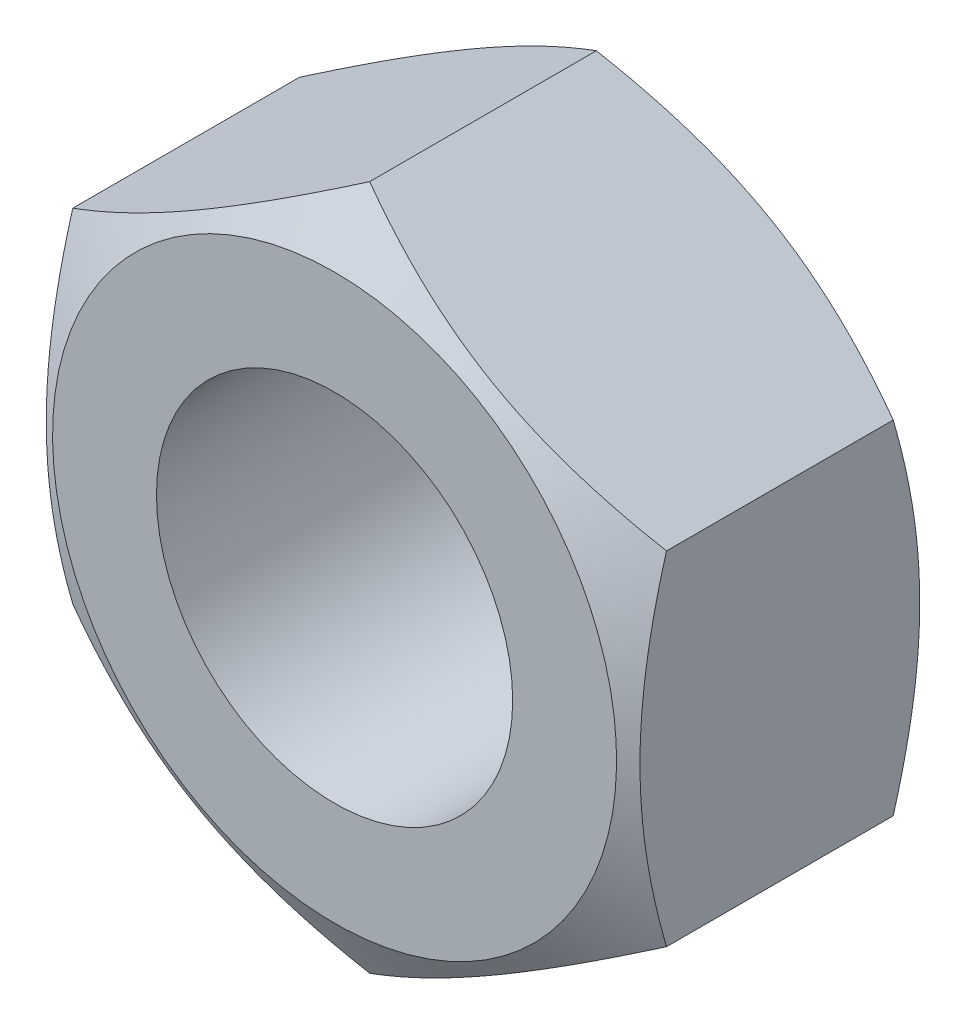
from build123d import *

# Parameters (mm, degrees)
SKETCH_1_R      = 0.6
EXTRUDE_1_DEPTH = 1


with BuildPart() as part:
    # Эскиз1 → Бобышка-Вытянуть1 (new body)
    with BuildSketch(Plane.XY):
        Polygon((0, 1.154700538), (-1, 0.577350269), (-1, -0.577350269), (0, -1.154700538), (1, -0.577350269), (1, 0.577350269), align=None)
        Circle(SKETCH_1_R, mode=Mode.SUBTRACT)
    extrude(amount=EXTRUDE_1_DEPTH)

    # Эскиз2 → Вырез-Повернуть1 (revolve, cut)
    with BuildSketch(Plane(origin=(0, 0, 0), x_dir=(0, 0, -1), z_dir=(1, 0, 0)), mode=Mode.PRIVATE) as cut_revolve_1_sk:
        Polygon((-1, 1.329278221), (-1, 0.95), (-0.781023617, 1.329278221), align=None)
        Polygon((0, 1.329278221), (0, 0.95), (-0.218976383, 1.329278221), align=None)
    revolve(cut_revolve_1_sk.sketch.rotate(Axis((0, 0, 0), (0, 0, 1)), 180), axis=Axis((0, 0, 0), (0, 0, 1)), mode=Mode.SUBTRACT)


solid = part.part
